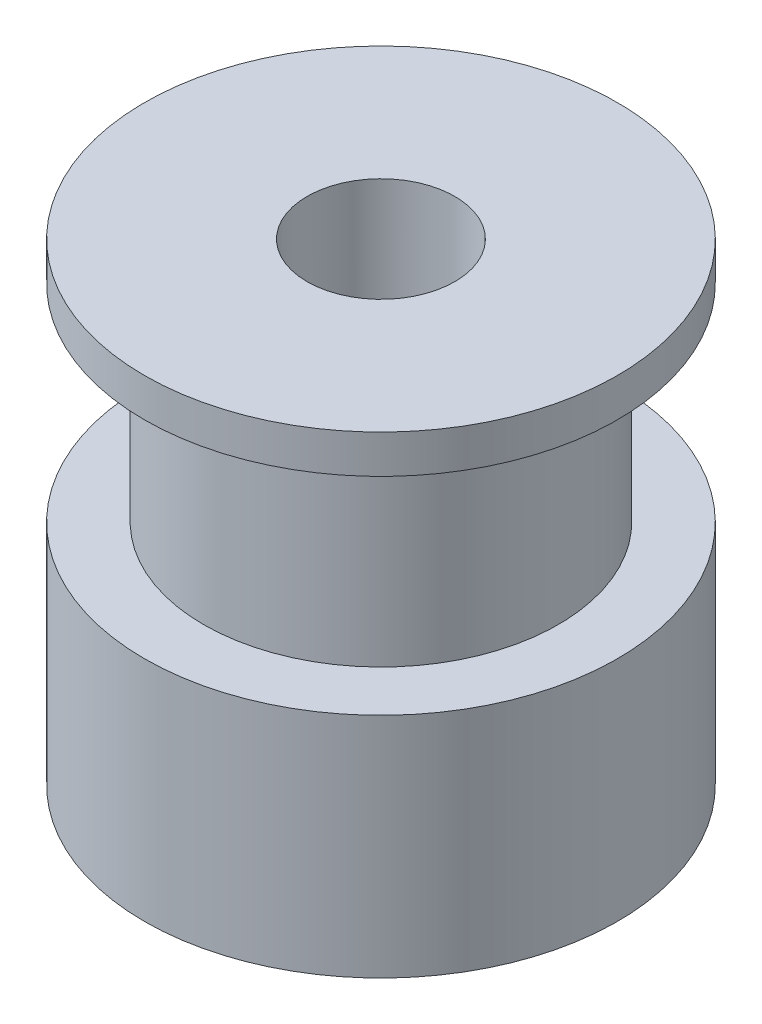
from build123d import *

# Parameters (mm, degrees)
SKETCH1_R           = 8
SKETCH1_R_2         = 2.5
BOSS_EXTRUDE1_DEPTH = 16
SKETCH2_W           = 2
SKETCH2_H           = 7
SKETCH3_R           = 1.55
CUT_EXTRUDE1_DEPTH  = 8
CIRPATTERN1_COUNT   = 2
CIRPATTERN1_ANGLE   = 90


with BuildPart() as part:
    # Sketch1 → Boss-Extrude1 (new body)
    with BuildSketch(Plane(origin=(0, 0, 0), x_dir=(1, 0, 0), z_dir=(0, 1, 0))):
        with Locations(Location((0, 0, 0), (0, 0, 270))):
            Circle(SKETCH1_R)
        with Locations(Location((0, 0, 0), (0, 0, 270))):
            Circle(SKETCH1_R_2, mode=Mode.SUBTRACT)
    extrude(amount=BOSS_EXTRUDE1_DEPTH)

    # Sketch2 → Cut-Revolve1 (revolve, cut)
    with BuildSketch(Plane.XY, mode=Mode.PRIVATE) as cut_revolve1_sk:
        with Locations((-7, 11.2)):
            Rectangle(SKETCH2_W, SKETCH2_H)
    revolve(cut_revolve1_sk.sketch.rotate(Axis((0, 16.938378215, 0), (0, -1, 0)), 270), axis=Axis((0, 16.938378215, 0), (0, -1, 0)), mode=Mode.SUBTRACT)

    # Sketch3 → Cut-Extrude1 (cut)
    with BuildSketch(Plane.ZY.offset(8)):
        with Locations((0, 3.7)):
            Circle(SKETCH3_R)
    cut_extrude1 = extrude(amount=-CUT_EXTRUDE1_DEPTH, mode=Mode.SUBTRACT)

    # CirPattern1: Cut-Extrude1 ×2 about axis
    cirpattern1_axis = Axis((0, 16, 0), (0, -1, 0))
    for i in range(1, CIRPATTERN1_COUNT):
        add(cut_extrude1.rotate(cirpattern1_axis, i * CIRPATTERN1_ANGLE / (CIRPATTERN1_COUNT - 1)), mode=Mode.SUBTRACT)


solid = part.part
